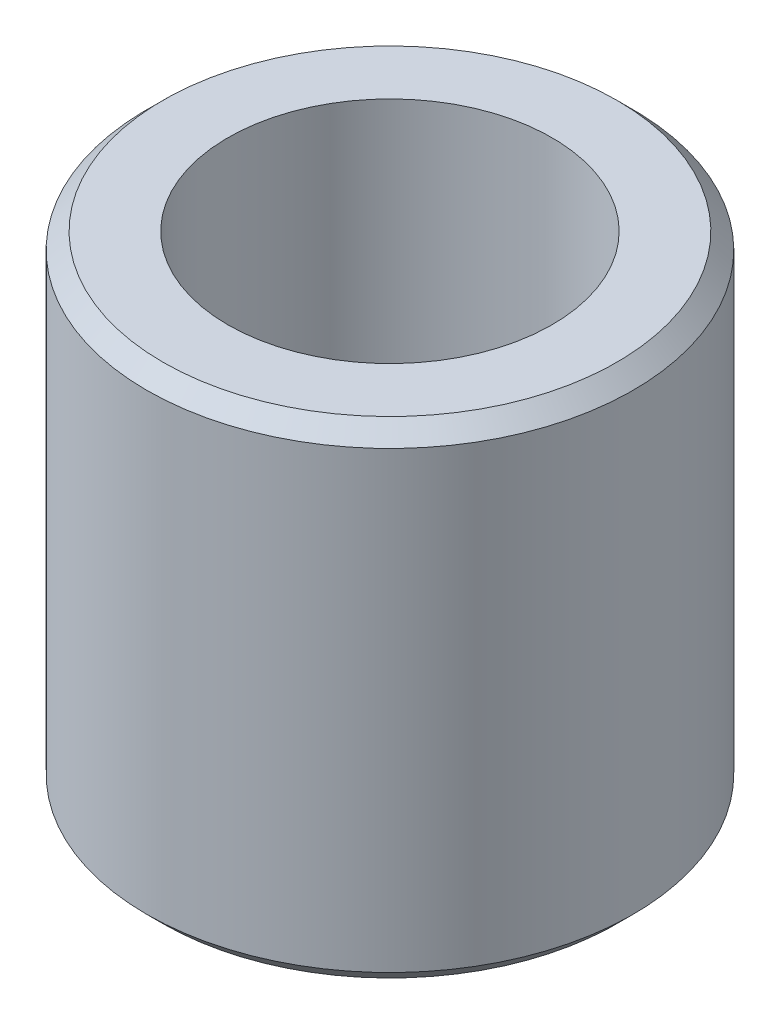
from build123d import *

# Parameters (mm, degrees)
SKETCH1_R           = 15
SKETCH1_R_2         = 10
BOSS_EXTRUDE1_DEPTH = 30
CHAMFER1_SIZE       = 1
CHAMFER2_SIZE       = 1


with BuildPart() as part:
    # Sketch1 → Boss-Extrude1 (new body)
    with BuildSketch(Plane(origin=(0, 0, 0), x_dir=(1, 0, 0), z_dir=(0, 1, 0))):
        with Locations(Location((0, 0, 0), (0, 0, 270))):
            Circle(SKETCH1_R)
        with Locations(Location((0, 0, 0), (0, 0, 270))):
            Circle(SKETCH1_R_2, mode=Mode.SUBTRACT)
    extrude(amount=BOSS_EXTRUDE1_DEPTH)

    # Chamfer1
    chamfer1_edges = [part.edges().sort_by_distance(p)[0] for p in [
        (0, 0, -15),
    ]]
    chamfer(chamfer1_edges, length=CHAMFER1_SIZE)

    # Chamfer2
    chamfer2_edges = [part.edges().sort_by_distance(p)[0] for p in [
        (0, 30, -15),
    ]]
    chamfer(chamfer2_edges, length=CHAMFER2_SIZE)


solid = part.part
